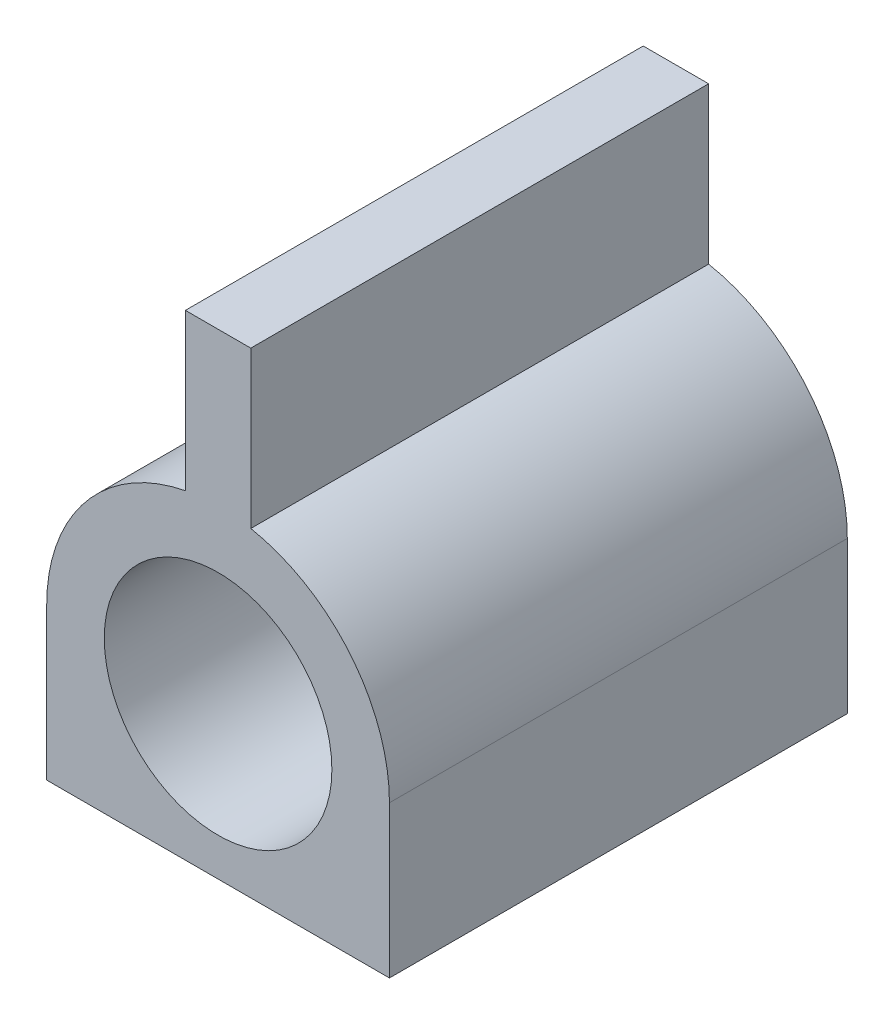
from build123d import *

# Parameters (mm, degrees)
SKETCH1_R           = 11.049
BOSS_EXTRUDE1_DEPTH = 22.225


with BuildPart() as part:
    # Sketch1 → Boss-Extrude1 (new, symmetric)
    with BuildSketch(Plane.XY):
        with BuildLine():
            Line((16.637, -14.732), (-16.637, -14.732))
            Line((-16.637, -14.732), (-16.637, 0))
            ThreePointArc((-16.637, 0), (-12.83768367, 10.582232609), (-3.175, 16.331232164))
            Line((-3.175, 16.331232164), (-3.175, 31.496))
            Line((-3.175, 31.496), (3.175, 31.496))
            Line((3.175, 31.496), (3.175, 16.331232164))
            ThreePointArc((3.175, 16.331232164), (12.83768367, 10.582232609), (16.637, 0))
            Line((16.637, 0), (16.637, -14.732))
        make_face()
        Circle(SKETCH1_R, mode=Mode.SUBTRACT)
    extrude(amount=BOSS_EXTRUDE1_DEPTH, both=True)


solid = part.part
